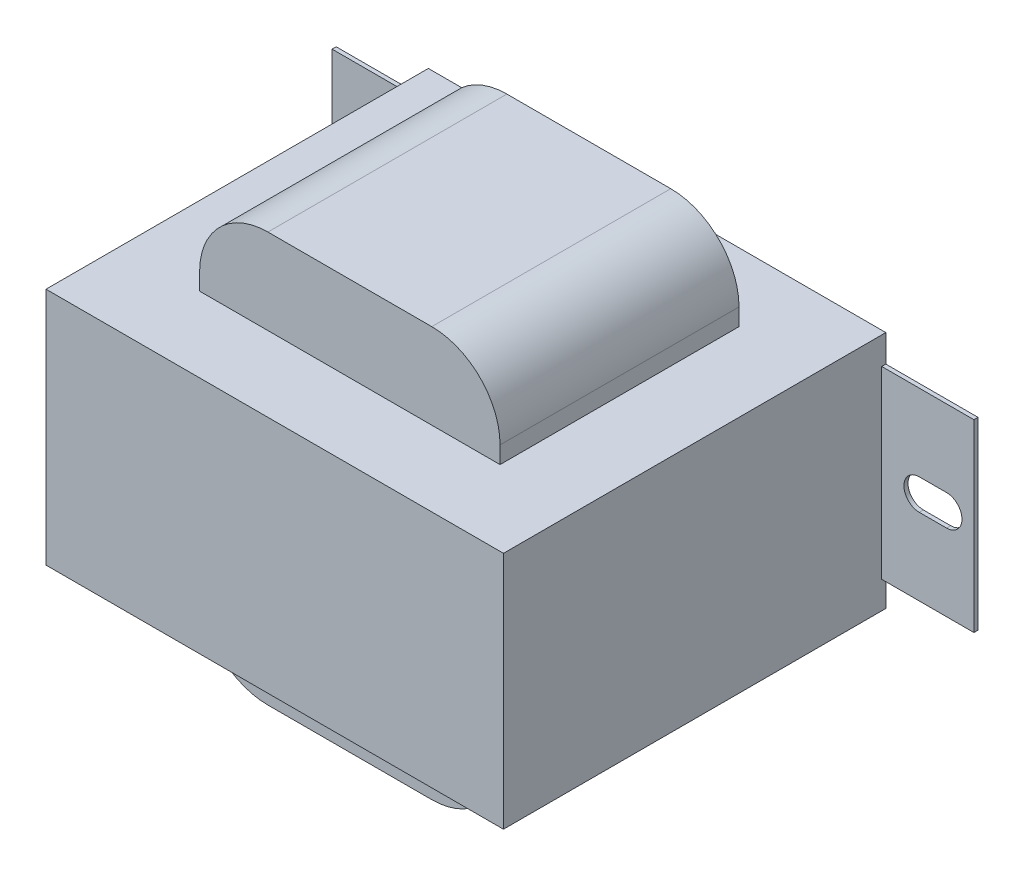
from build123d import *

# Parameters (mm, degrees)
SKETCH_1_W      = 67
SKETCH_1_H      = 35
EXTRUDE_1_DEPTH = 56
EXTRUDE_START   = -11
EXTRUDE_2_DEPTH = 35
SKETCH_3_W      = 13.5
SKETCH_3_H      = 27
EXTRUDE_3_DEPTH = 0.6


with BuildPart() as part:
    # 草图1 → 拉伸1 (new body)
    with BuildSketch(Plane.XY):
        Rectangle(SKETCH_1_W, SKETCH_1_H)
    extrude(amount=EXTRUDE_1_DEPTH)

    # 草图2 → 拉伸2 (add)
    with BuildSketch(Plane.XY.offset(56).offset(EXTRUDE_START)):
        with BuildLine():
            Line((-12, 30), (12, 30))
            ThreePointArc((12, 30), (19.071067812, 27.071067812), (22, 20))
            Line((22, 20), (22, -20))
            ThreePointArc((22, -20), (19.071067812, -27.071067812), (12, -30))
            Line((12, -30), (-12, -30))
            ThreePointArc((-12, -30), (-19.071067812, -27.071067812), (-22, -20))
            Line((-22, -20), (-22, 20))
            ThreePointArc((-22, 20), (-19.071067812, 27.071067812), (-12, 30))
        make_face()
    extrude(amount=-EXTRUDE_2_DEPTH)

    # 草图3 → 拉伸3 (add)
    # profile 1 of 2: a face of its own
    with BuildSketch(Plane(origin=(0, 0, 0), x_dir=(-1, 0, 0), z_dir=(0, 0, -1))):
        with Locations((-40.25, 0)):
            Rectangle(SKETCH_3_W, SKETCH_3_H)
        with BuildLine():
            Line((-43, 2.25), (-39, 2.25))
            ThreePointArc((-39, 2.25), (-36.75, 0), (-39, -2.25))
            Line((-39, -2.25), (-43, -2.25))
            ThreePointArc((-43, -2.25), (-45.25, 0), (-43, 2.25))
        make_face(mode=Mode.SUBTRACT)
    # profile 2 of 2: a face of its own
    with BuildSketch(Plane(origin=(0, 0, 0), x_dir=(-1, 0, 0), z_dir=(0, 0, -1))):
        with Locations((40.25, 0)):
            Rectangle(SKETCH_3_W, SKETCH_3_H)
        with BuildLine():
            Line((43, 2.25), (39, 2.25))
            ThreePointArc((39, 2.25), (36.75, 0), (39, -2.25))
            Line((39, -2.25), (43, -2.25))
            ThreePointArc((43, -2.25), (45.25, 0), (43, 2.25))
        make_face(mode=Mode.SUBTRACT)
    extrude(amount=-EXTRUDE_3_DEPTH)


solid = part.part
